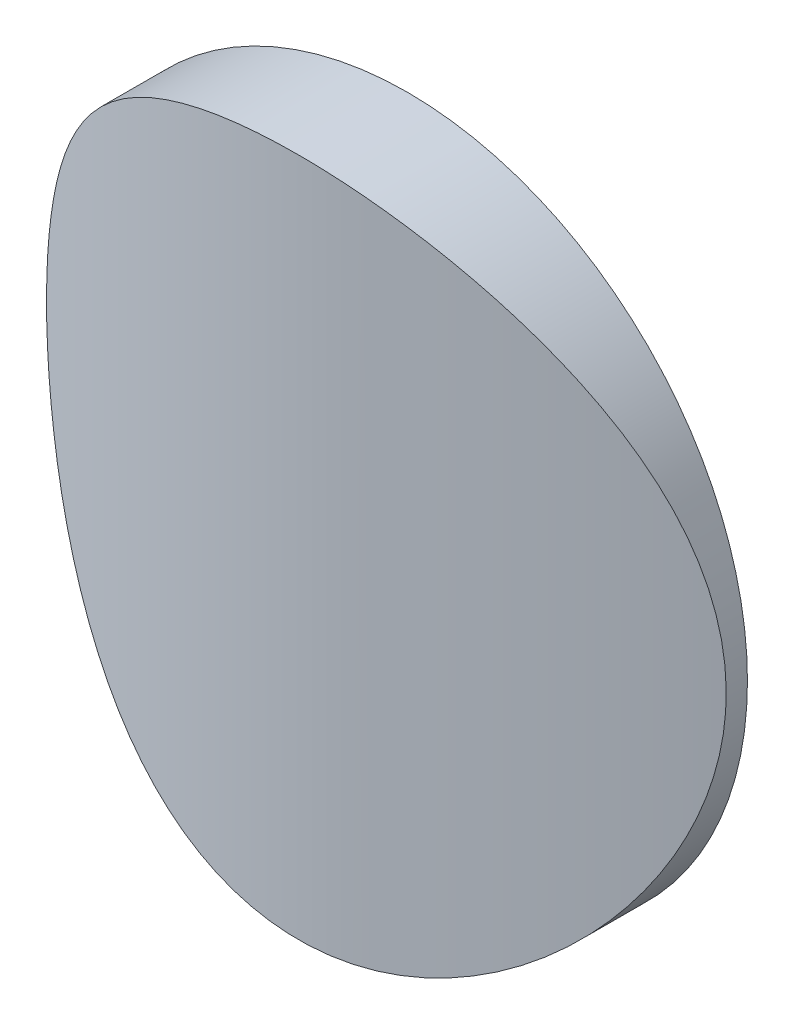
from build123d import *

# Parameters (mm, degrees)
SKETCH1_R               = 25.4
BOSS_EXTRUDE1_DEPTH     = 25.4
CUT_EXTRUDE3_DEPTH      = 44.994090512
CUT_EXTRUDE3_DEPTH_BACK = 44.994090512
SKETCH4_OUTSIDE_W       = 42.64
SKETCH4_OUTSIDE_H       = 68.04
SKETCH4_OUTSIDE_R       = 52.578


with BuildPart() as part:
    # Sketch1 → Boss-Extrude1 (new body)
    with BuildSketch(Plane.XY):
        Circle(SKETCH1_R)
    extrude(amount=BOSS_EXTRUDE1_DEPTH)

    # Sketch4 outside → Cut-Extrude3 (cut, two sides: drawn at the far end of the back side and taken through both)
    with BuildSketch(Plane(origin=(0, 0, 0), x_dir=(0, 0, -1), z_dir=(0, 1, 0)).offset(-CUT_EXTRUDE3_DEPTH_BACK)):
        with Locations((-12.7, 0)):
            Rectangle(SKETCH4_OUTSIDE_W, SKETCH4_OUTSIDE_H)
        with Locations((44.45, 0)):
            Circle(SKETCH4_OUTSIDE_R, mode=Mode.SUBTRACT)
    extrude(amount=CUT_EXTRUDE3_DEPTH + CUT_EXTRUDE3_DEPTH_BACK, mode=Mode.SUBTRACT)


solid = part.part
